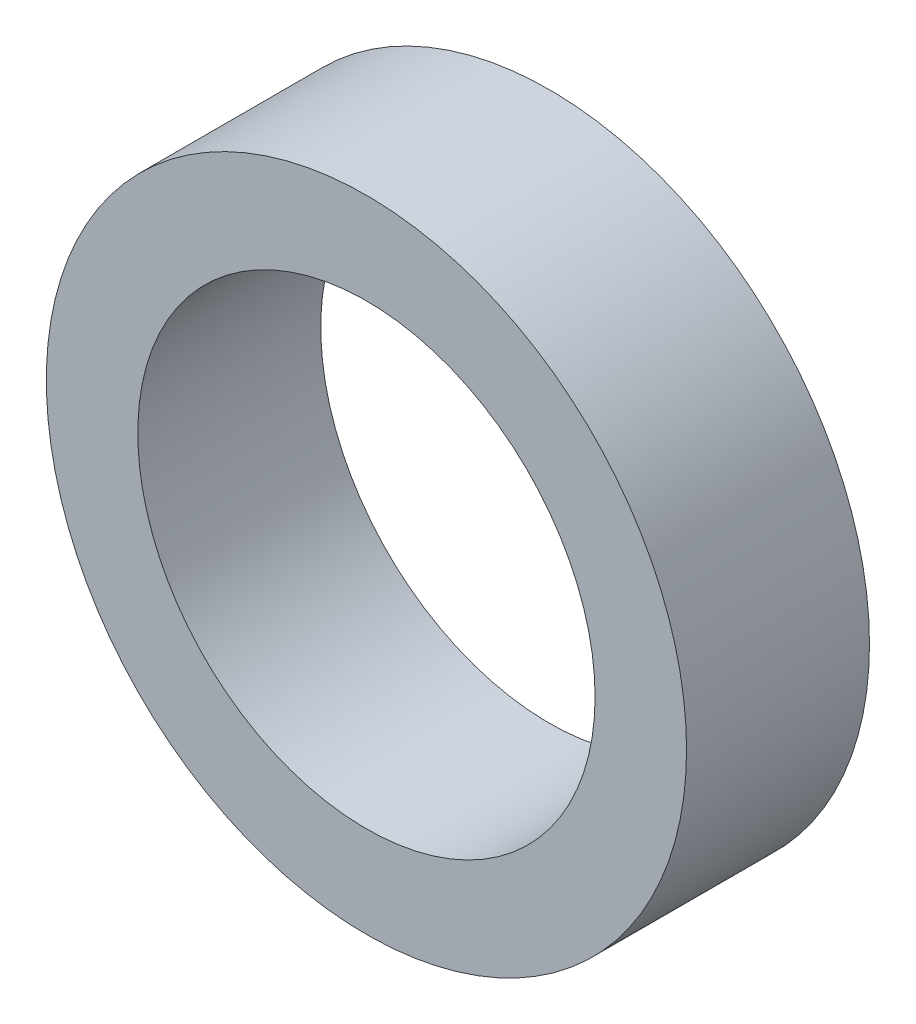
from build123d import *

# Parameters (mm, degrees)
SKETCH1_R           = 11.1125
SKETCH1_R_2         = 7.9375
BOSS_EXTRUDE1_DEPTH = 6.35


with BuildPart() as part:
    # Sketch1 → Boss-Extrude1 (new body)
    with BuildSketch(Plane(origin=(0, 0, 0), x_dir=(0, 1, 0), z_dir=(0, 0, 1))):
        with Locations(Location((0, 0, 0), (0, 0, 270))):
            Circle(SKETCH1_R)
        with Locations(Location((0, 0, 0), (0, 0, 270))):
            Circle(SKETCH1_R_2, mode=Mode.SUBTRACT)
    extrude(amount=BOSS_EXTRUDE1_DEPTH)


solid = part.part
